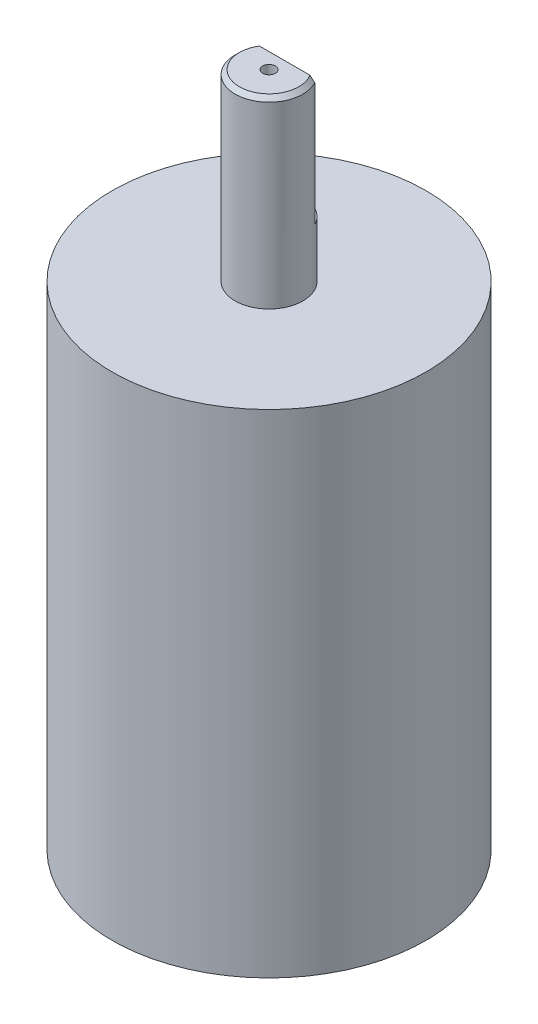
from build123d import *

# Parameters (mm, degrees)
CHAMFER1_SIZE      = 0.5
CUT_EXTRUDE1_START = -15
CUT_EXTRUDE1_DEPTH = 15
SKETCH3_R          = 0.75
CUT_EXTRUDE2_DEPTH = 86.691656537


with BuildPart() as part:
    # Sketch1 → Revolve1 (revolve)
    with BuildSketch(Plane(origin=(0, 0, 0), x_dir=(0, 0, -1), z_dir=(1, 0, 0))):
        Polygon((0, -40.8), (0, 40.8), (4, 40.8), (4, 19.2), (18.5, 19.2), (18.5, -38.8), (4, -38.8), (4, -40.8), align=None)
    revolve(axis=Axis((0, -40.8, 0), (0, 1, 0)))

    # Chamfer1
    chamfer1_edges = [part.edges().sort_by_distance(p)[0] for p in [
        (0, 40.8, 4),
    ]]
    chamfer(chamfer1_edges, length=CHAMFER1_SIZE)

    # Sketch2 → Cut-Extrude1 (cut)
    with BuildSketch(Plane(origin=(0, 40.8, 0), x_dir=(1, 0, 0), z_dir=(0, 1, 0)).offset(CUT_EXTRUDE1_START)):
        with BuildLine():
            Line((-3.551675661, 1.84), (3.551675661, 1.84))
            ThreePointArc((3.551675661, 1.84), (0, 4), (-3.551675661, 1.84))
        make_face()
    extrude(amount=CUT_EXTRUDE1_DEPTH, mode=Mode.SUBTRACT)

    # Sketch3 → Cut-Extrude2 (cut, through all)
    with BuildSketch(Plane(origin=(0, 40.8, 0), x_dir=(1, 0, 0), z_dir=(0, 1, 0))):
        with Locations(Location((0, 0, 0), (0, 0, 270))):
            Circle(SKETCH3_R)
    extrude(amount=-CUT_EXTRUDE2_DEPTH, mode=Mode.SUBTRACT)


solid = part.part
